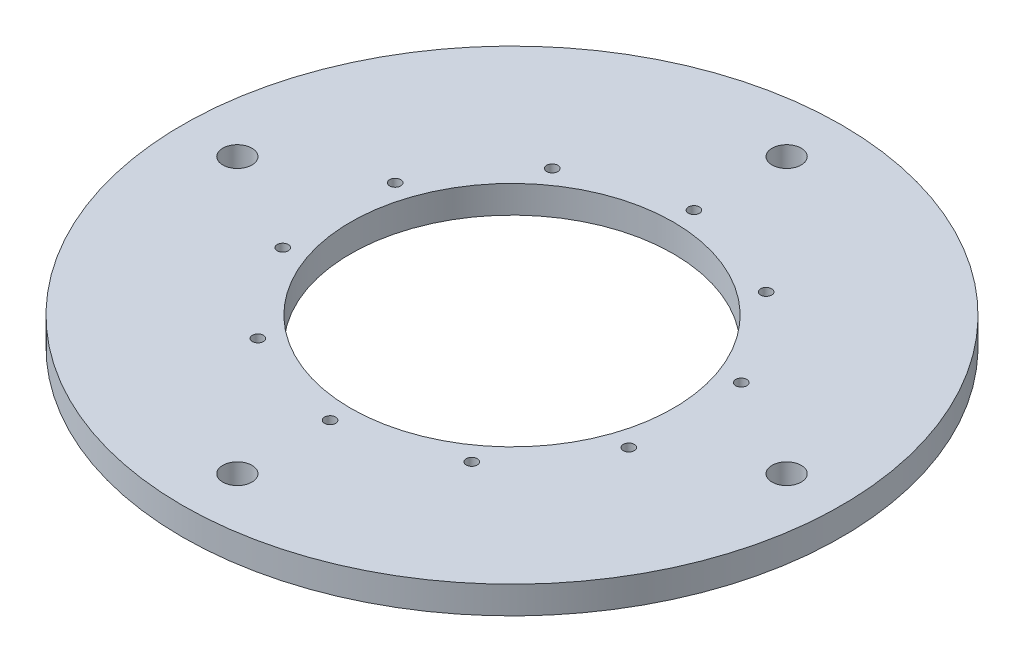
from build123d import *

# Parameters (mm, degrees)
SKETCH1_R                           = 152.4
SKETCH1_R_2                         = 74.6125
THRUSTPLATE_TC3_DEPTH               = 12.7
UNDEF_CLEARANCE_THRUSTPLATE_D       = 13.49248
CLEARANCE_THRUSTPLATE_PATTERN_COUNT = 4
F_10_CLEARANCE_HOLE1_D              = 5.1054
CIRPATTERN1_COUNT                   = 10


with BuildPart() as part:
    # Sketch1 → ThrustPlate_TC3 (new body)
    with BuildSketch(Plane(origin=(0, 0, 0), x_dir=(1, 0, 0), z_dir=(0, 1, 0))):
        with Locations(Location((0, 0, 0), (0, 0, 270))):
            Circle(SKETCH1_R)
        with Locations(Location((0, 0, 0), (0, 0, 270))):
            Circle(SKETCH1_R_2, mode=Mode.SUBTRACT)
    extrude(amount=-THRUSTPLATE_TC3_DEPTH)

    # UNDEF_Clearance_ThrustPlate (through all)
    with Locations(Plane(origin=(0, 0, 0), x_dir=(1, 0, 0), z_dir=(0, 1, 0))):
        with Locations((0, 127)):
            undef_clearance_thrustplate = Hole(UNDEF_CLEARANCE_THRUSTPLATE_D / 2)

    # Clearance_ThrustPlate_Pattern: UNDEF_Clearance_ThrustPlate ×4 about axis
    clearance_thrustplate_pattern_axis = Axis((0, 0, 0), (0, 1, 0))
    for i in range(1, CLEARANCE_THRUSTPLATE_PATTERN_COUNT):
        add(undef_clearance_thrustplate.rotate(clearance_thrustplate_pattern_axis, i * 360 / CLEARANCE_THRUSTPLATE_PATTERN_COUNT), mode=Mode.SUBTRACT)

    # #10 Clearance Hole1 (through all)
    with Locations(Plane(origin=(0, 0, 0), x_dir=(1, 0, 0), z_dir=(0, 1, 0))):
        with Locations((0, 84.1375)):
            f_10_clearance_hole1 = Hole(F_10_CLEARANCE_HOLE1_D / 2)

    # CirPattern1: #10 Clearance Hole1 ×10 about axis
    cirpattern1_axis = Axis((0, 0, 0), (0, 1, 0))
    for i in range(1, CIRPATTERN1_COUNT):
        add(f_10_clearance_hole1.rotate(cirpattern1_axis, i * 360 / CIRPATTERN1_COUNT), mode=Mode.SUBTRACT)


solid = part.part
